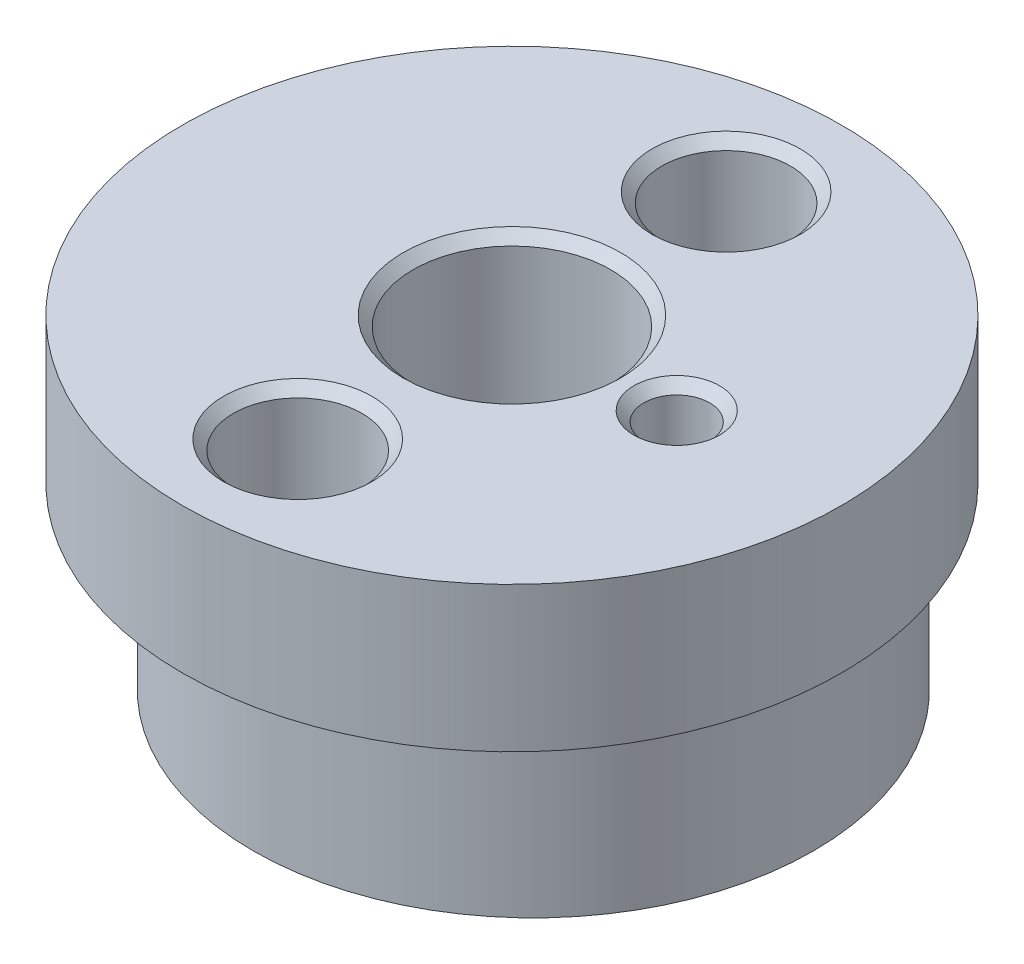
from build123d import *

# Parameters (mm, degrees)
SKETCH1_R                  = 8.5
BOSS_EXTRUDE1_DEPTH        = 5.5
BOSS_EXTRUDE2_DEPTH        = 4
BOSS_EXTRUDE2_DEPTH_BACK   = 0.4
SKETCH2_R                  = 10
SKETCH3_R                  = 3
CUT_EXTRUDE1_DEPTH         = 18.426201537
SKETCH6_R                  = 1
CUT_EXTRUDE4_DEPTH         = 18.426201537
F_3_2_3_2_DIAMETER_HOLE1_D = 3.2
SKETCH10_R                 = 1.95
CUT_EXTRUDE5_DEPTH         = 4
CHAMFER1_SIZE              = 0.3


with BuildPart() as part:
    # Sketch1 → Boss-Extrude1 (new body)
    with BuildSketch(Plane(origin=(0, 0, 0), x_dir=(1, 0, 0), z_dir=(0, 1, 0))):
        with Locations(Location((0, 0, 0), (0, 0, 270))):
            Circle(SKETCH1_R)
    extrude(amount=BOSS_EXTRUDE1_DEPTH)

    # Sketch2 → Boss-Extrude2 (add, two sides: drawn at the far end of the back side and taken through both)
    with BuildSketch(Plane(origin=(0, 5.5, 0), x_dir=(1, 0, 0), z_dir=(0, 1, 0)).offset(-BOSS_EXTRUDE2_DEPTH_BACK)):
        with Locations(Location((-0.65, 0, 0), (0, 0, 270))):
            Circle(SKETCH2_R)
    extrude(amount=BOSS_EXTRUDE2_DEPTH + BOSS_EXTRUDE2_DEPTH_BACK)

    # Sketch3 → Cut-Extrude1 (cut, through all)
    with BuildSketch(Plane.XZ):
        with Locations(Location((-0.65, 0, 0), (0, 0, 270))):
            Circle(SKETCH3_R)
    extrude(amount=-CUT_EXTRUDE1_DEPTH, mode=Mode.SUBTRACT)

    # Sketch6 → Cut-Extrude4 (cut, through all)
    with BuildSketch(Plane.XZ):
        with Locations(Location((4.35, 0, 0), (0, 0, 270))):
            Circle(SKETCH6_R)
    extrude(amount=-CUT_EXTRUDE4_DEPTH, mode=Mode.SUBTRACT)

    # Ø3.2 (3.2) Diameter Hole1 (through all)
    with Locations(Plane(origin=(0, 0, 0), x_dir=(-1, 0, 0), z_dir=(0, -1, 0))):
        with Locations((0.65, 6.5), (0.65, -6.5)):
            Hole(F_3_2_3_2_DIAMETER_HOLE1_D / 2)

    # Sketch10 → Cut-Extrude5 (cut)
    with BuildSketch(Plane(origin=(0, 9.5, 0), x_dir=(1, 0, 0), z_dir=(0, 1, 0))):
        with Locations(Location((-0.65, 6.5, 0), (0, 0, 270))):
            Circle(SKETCH10_R)
        with Locations(Location((-0.65, -6.5, 0), (0, 0, 270))):
            Circle(SKETCH10_R)
    extrude(amount=-CUT_EXTRUDE5_DEPTH, mode=Mode.SUBTRACT)

    # Chamfer1
    chamfer1_edges = [part.edges().sort_by_distance(p)[0] for p in [
        (-0.65, 9.5, 3),
        (-0.65, 0, 3),
        (4.35, 9.5, 1),
        (4.35, 0, 1),
        (-2.25, 0, 6.5),
        (-2.25, 0, -6.5),
        (-0.65, 9.5, -8.45),
        (-0.65, 9.5, 4.55),
    ]]
    chamfer(chamfer1_edges, length=CHAMFER1_SIZE)


solid = part.part
